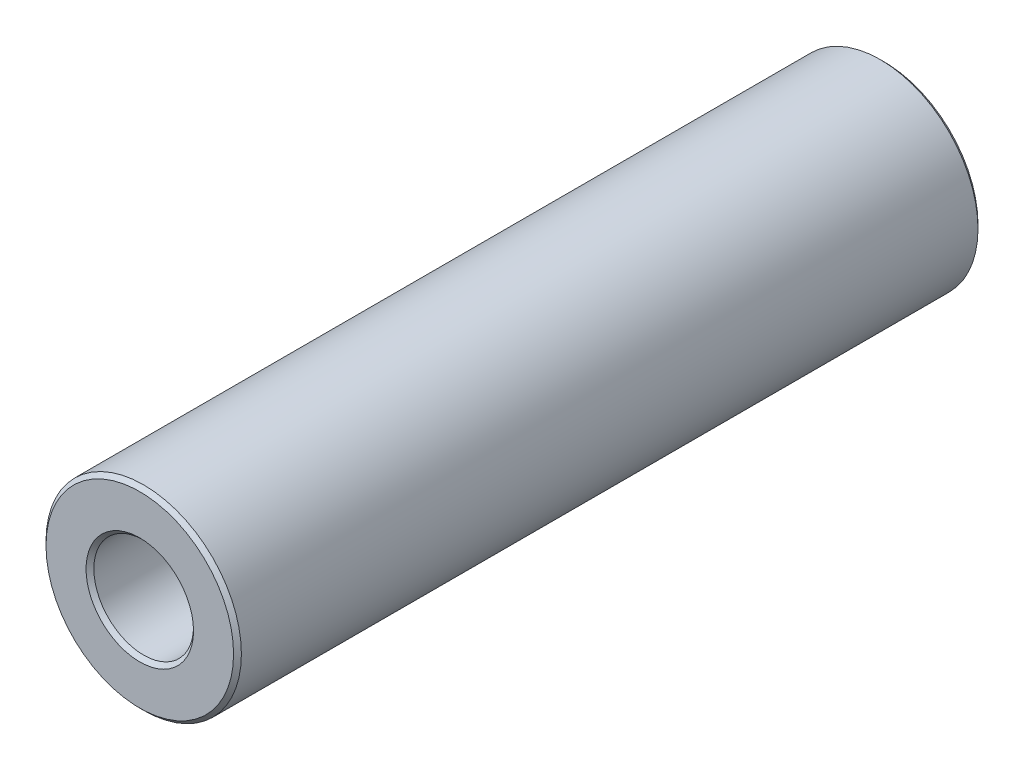
from build123d import *

# Parameters (mm, degrees)
SKETCH1_R           = 5
SKETCH1_R_2         = 2.55
BOSS_EXTRUDE1_DEPTH = 38.1
CHAMFER1_SIZE       = 0.2


with BuildPart() as part:
    # Sketch1 → Boss-Extrude1 (new body)
    with BuildSketch(Plane.XY):
        with Locations(Location((0, 0, 0), (0, 0, 180))):
            Circle(SKETCH1_R)
        with Locations(Location((0, 0, 0), (0, 0, 180))):
            Circle(SKETCH1_R_2, mode=Mode.SUBTRACT)
    extrude(amount=BOSS_EXTRUDE1_DEPTH)

    # Chamfer1
    chamfer1_edges = [part.edges().sort_by_distance(p)[0] for p in [
        (5, 0, 0),
        (5, 0, 38.1),
        (2.55, 0, 0),
        (2.55, 0, 38.1),
    ]]
    chamfer(chamfer1_edges, length=CHAMFER1_SIZE)


solid = part.part
